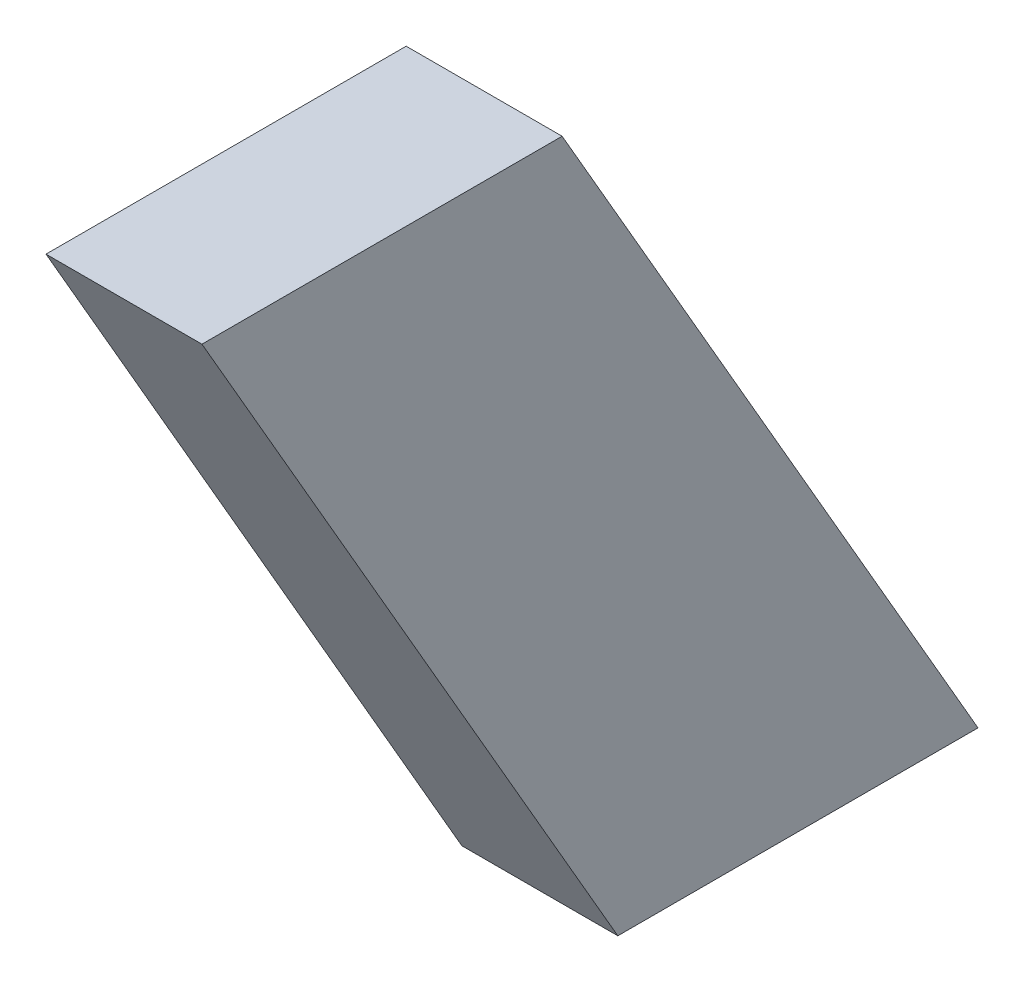
from build123d import *

# Parameters (mm, degrees)
BOSS_EXTRUDE1_DEPTH = 19.05


with BuildPart() as part:
    # Sketch2 → Boss-Extrude1 (new body)
    with BuildSketch(Plane(origin=(0, 0, 0), x_dir=(0, 0, -1), z_dir=(1, 0, 0))):
        Polygon((0, 0), (43.994090512, 0), (94.794090512, -87.988181024), (50.8, -87.988181024), align=None)
    extrude(amount=BOSS_EXTRUDE1_DEPTH)


solid = part.part
